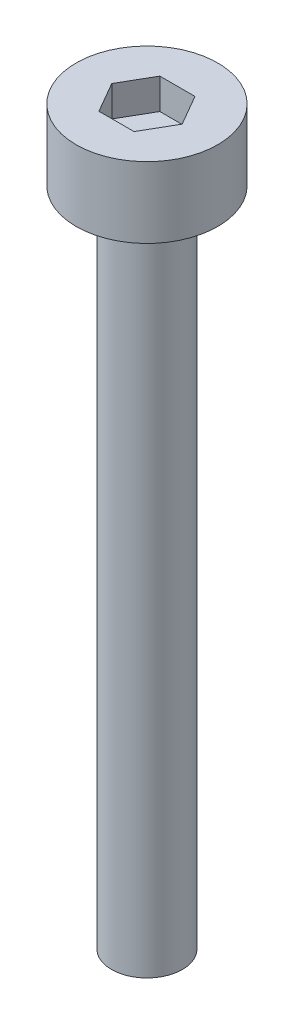
from build123d import *

# Parameters (mm, degrees)
SKETCH1_R           = 1.5
SCREWSHAFT_DEPTH    = 28
SKETCH2_R           = 3
BOSS_EXTRUDE2_DEPTH = 3
CUT_EXTRUDE1_DEPTH  = 1.3


with BuildPart() as part:
    # Sketch1 → ScrewShaft (new body)
    with BuildSketch(Plane(origin=(0, 0, 0), x_dir=(1, 0, 0), z_dir=(0, 1, 0))):
        with Locations(Location((0, 0, 0), (0, 0, 270))):
            Circle(SKETCH1_R)
    extrude(amount=SCREWSHAFT_DEPTH)

    # Sketch2 → Boss-Extrude2 (add)
    with BuildSketch(Plane(origin=(0, 28, 0), x_dir=(1, 0, 0), z_dir=(0, 1, 0))):
        with Locations(Location((0, 0, 0), (0, 0, 270))):
            Circle(SKETCH2_R)
    extrude(amount=BOSS_EXTRUDE2_DEPTH)

    # Sketch3 → Cut-Extrude1 (cut)
    with BuildSketch(Plane(origin=(0, 31, 0), x_dir=(1, 0, 0), z_dir=(0, 1, 0))):
        Polygon((1.489563695, 0), (0.744781847, 1.29), (-0.744781847, 1.29), (-1.489563695, 0), (-0.744781847, -1.29), (0.744781847, -1.29), align=None)
    extrude(amount=-CUT_EXTRUDE1_DEPTH, mode=Mode.SUBTRACT)


solid = part.part
